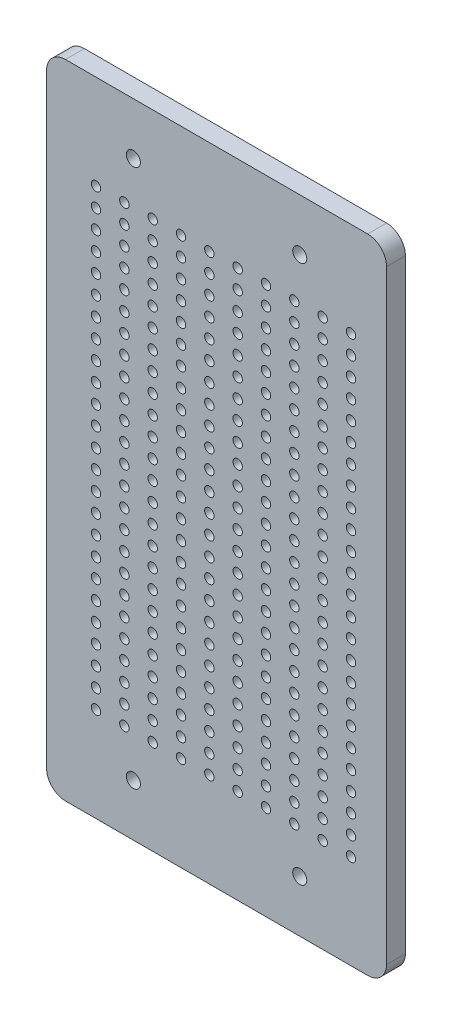
from build123d import *

# Parameters (mm, degrees)
SKETCH_1_R      = 3.725
SKETCH_1_R_2    = 2.5
EXTRUDE_1_DEPTH = 10


with BuildPart() as part:
    # 草图1 → 凸台-拉伸1 (new body)
    with BuildSketch(Plane.XY):
        with BuildLine():
            Line((-80, 170), (80, 170))
            ThreePointArc((80, 170), (87.071067812, 167.071067812), (90, 160))
            Line((90, 160), (90, -160))
            ThreePointArc((90, -160), (87.071067812, -167.071067812), (80, -170))
            Line((80, -170), (-80, -170))
            ThreePointArc((-80, -170), (-87.071067812, -167.071067812), (-90, -160))
            Line((-90, -160), (-90, 160))
            ThreePointArc((-90, 160), (-87.071067812, 167.071067812), (-80, 170))
        make_face()
        with Locations((-44.05, -142.55)):
            Circle(SKETCH_1_R, mode=Mode.SUBTRACT)
        with Locations(Location((44.05, -142.55, 0), (0, 0, 180))):
            Circle(SKETCH_1_R, mode=Mode.SUBTRACT)
        with Locations((44.05, 142.55)):
            Circle(SKETCH_1_R, mode=Mode.SUBTRACT)
        with Locations(Location((-44.05, 142.55, 0), (0, 0, 180))):
            Circle(SKETCH_1_R, mode=Mode.SUBTRACT)
        with Locations((-63.816557391, -120)):
            Circle(SKETCH_1_R_2, mode=Mode.SUBTRACT)
        with Locations((-48.816557391, -120)):
            Circle(SKETCH_1_R_2, mode=Mode.SUBTRACT)
        with Locations((-33.816557391, -120)):
            Circle(SKETCH_1_R_2, mode=Mode.SUBTRACT)
        with Locations((-18.816557391, -120)):
            Circle(SKETCH_1_R_2, mode=Mode.SUBTRACT)
        with Locations((-3.816557391, -120)):
            Circle(SKETCH_1_R_2, mode=Mode.SUBTRACT)
        with Locations((11.183442609, -120)):
            Circle(SKETCH_1_R_2, mode=Mode.SUBTRACT)
        with Locations((26.183442609, -120)):
            Circle(SKETCH_1_R_2, mode=Mode.SUBTRACT)
        with Locations((41.183442609, -120)):
            Circle(SKETCH_1_R_2, mode=Mode.SUBTRACT)
        with Locations((56.183442609, -120)):
            Circle(SKETCH_1_R_2, mode=Mode.SUBTRACT)
        with Locations((71.183442609, -120)):
            Circle(SKETCH_1_R_2, mode=Mode.SUBTRACT)
        with Locations((-48.816557391, -110)):
            Circle(SKETCH_1_R_2, mode=Mode.SUBTRACT)
        with Locations((-33.816557391, -110)):
            Circle(SKETCH_1_R_2, mode=Mode.SUBTRACT)
        with Locations((-18.816557391, -110)):
            Circle(SKETCH_1_R_2, mode=Mode.SUBTRACT)
        with Locations((-3.816557391, -110)):
            Circle(SKETCH_1_R_2, mode=Mode.SUBTRACT)
        with Locations((11.183442609, -110)):
            Circle(SKETCH_1_R_2, mode=Mode.SUBTRACT)
        with Locations((26.183442609, -110)):
            Circle(SKETCH_1_R_2, mode=Mode.SUBTRACT)
        with Locations((41.183442609, -110)):
            Circle(SKETCH_1_R_2, mode=Mode.SUBTRACT)
        with Locations((56.183442609, -110)):
            Circle(SKETCH_1_R_2, mode=Mode.SUBTRACT)
        with Locations((71.183442609, -110)):
            Circle(SKETCH_1_R_2, mode=Mode.SUBTRACT)
        with Locations((-48.816557391, -100)):
            Circle(SKETCH_1_R_2, mode=Mode.SUBTRACT)
        with Locations((-33.816557391, -100)):
            Circle(SKETCH_1_R_2, mode=Mode.SUBTRACT)
        with Locations((-18.816557391, -100)):
            Circle(SKETCH_1_R_2, mode=Mode.SUBTRACT)
        with Locations((-3.816557391, -100)):
            Circle(SKETCH_1_R_2, mode=Mode.SUBTRACT)
        with Locations((11.183442609, -100)):
            Circle(SKETCH_1_R_2, mode=Mode.SUBTRACT)
        with Locations((26.183442609, -100)):
            Circle(SKETCH_1_R_2, mode=Mode.SUBTRACT)
        with Locations((41.183442609, -100)):
            Circle(SKETCH_1_R_2, mode=Mode.SUBTRACT)
        with Locations((56.183442609, -100)):
            Circle(SKETCH_1_R_2, mode=Mode.SUBTRACT)
        with Locations((71.183442609, -100)):
            Circle(SKETCH_1_R_2, mode=Mode.SUBTRACT)
        with Locations((-48.816557391, -90)):
            Circle(SKETCH_1_R_2, mode=Mode.SUBTRACT)
        with Locations((-33.816557391, -90)):
            Circle(SKETCH_1_R_2, mode=Mode.SUBTRACT)
        with Locations((-18.816557391, -90)):
            Circle(SKETCH_1_R_2, mode=Mode.SUBTRACT)
        with Locations((-3.816557391, -90)):
            Circle(SKETCH_1_R_2, mode=Mode.SUBTRACT)
        with Locations((11.183442609, -90)):
            Circle(SKETCH_1_R_2, mode=Mode.SUBTRACT)
        with Locations((26.183442609, -90)):
            Circle(SKETCH_1_R_2, mode=Mode.SUBTRACT)
        with Locations((41.183442609, -90)):
            Circle(SKETCH_1_R_2, mode=Mode.SUBTRACT)
        with Locations((56.183442609, -90)):
            Circle(SKETCH_1_R_2, mode=Mode.SUBTRACT)
        with Locations((71.183442609, -90)):
            Circle(SKETCH_1_R_2, mode=Mode.SUBTRACT)
        with Locations((-48.816557391, -80)):
            Circle(SKETCH_1_R_2, mode=Mode.SUBTRACT)
        with Locations((-33.816557391, -80)):
            Circle(SKETCH_1_R_2, mode=Mode.SUBTRACT)
        with Locations((-18.816557391, -80)):
            Circle(SKETCH_1_R_2, mode=Mode.SUBTRACT)
        with Locations((-3.816557391, -80)):
            Circle(SKETCH_1_R_2, mode=Mode.SUBTRACT)
        with Locations((11.183442609, -80)):
            Circle(SKETCH_1_R_2, mode=Mode.SUBTRACT)
        with Locations((26.183442609, -80)):
            Circle(SKETCH_1_R_2, mode=Mode.SUBTRACT)
        with Locations((41.183442609, -80)):
            Circle(SKETCH_1_R_2, mode=Mode.SUBTRACT)
        with Locations((56.183442609, -80)):
            Circle(SKETCH_1_R_2, mode=Mode.SUBTRACT)
        with Locations((71.183442609, -80)):
            Circle(SKETCH_1_R_2, mode=Mode.SUBTRACT)
        with Locations((-48.816557391, -70)):
            Circle(SKETCH_1_R_2, mode=Mode.SUBTRACT)
        with Locations((-33.816557391, -70)):
            Circle(SKETCH_1_R_2, mode=Mode.SUBTRACT)
        with Locations((-18.816557391, -70)):
            Circle(SKETCH_1_R_2, mode=Mode.SUBTRACT)
        with Locations((-3.816557391, -70)):
            Circle(SKETCH_1_R_2, mode=Mode.SUBTRACT)
        with Locations((11.183442609, -70)):
            Circle(SKETCH_1_R_2, mode=Mode.SUBTRACT)
        with Locations((26.183442609, -70)):
            Circle(SKETCH_1_R_2, mode=Mode.SUBTRACT)
        with Locations((41.183442609, -70)):
            Circle(SKETCH_1_R_2, mode=Mode.SUBTRACT)
        with Locations((56.183442609, -70)):
            Circle(SKETCH_1_R_2, mode=Mode.SUBTRACT)
        with Locations((71.183442609, -70)):
            Circle(SKETCH_1_R_2, mode=Mode.SUBTRACT)
        with Locations((-48.816557391, -60)):
            Circle(SKETCH_1_R_2, mode=Mode.SUBTRACT)
        with Locations((-33.816557391, -60)):
            Circle(SKETCH_1_R_2, mode=Mode.SUBTRACT)
        with Locations((-18.816557391, -60)):
            Circle(SKETCH_1_R_2, mode=Mode.SUBTRACT)
        with Locations((-3.816557391, -60)):
            Circle(SKETCH_1_R_2, mode=Mode.SUBTRACT)
        with Locations((11.183442609, -60)):
            Circle(SKETCH_1_R_2, mode=Mode.SUBTRACT)
        with Locations((26.183442609, -60)):
            Circle(SKETCH_1_R_2, mode=Mode.SUBTRACT)
        with Locations((41.183442609, -60)):
            Circle(SKETCH_1_R_2, mode=Mode.SUBTRACT)
        with Locations((56.183442609, -60)):
            Circle(SKETCH_1_R_2, mode=Mode.SUBTRACT)
        with Locations((71.183442609, -60)):
            Circle(SKETCH_1_R_2, mode=Mode.SUBTRACT)
        with Locations((-48.816557391, -50)):
            Circle(SKETCH_1_R_2, mode=Mode.SUBTRACT)
        with Locations((-33.816557391, -50)):
            Circle(SKETCH_1_R_2, mode=Mode.SUBTRACT)
        with Locations((-18.816557391, -50)):
            Circle(SKETCH_1_R_2, mode=Mode.SUBTRACT)
        with Locations((-3.816557391, -50)):
            Circle(SKETCH_1_R_2, mode=Mode.SUBTRACT)
        with Locations((11.183442609, -50)):
            Circle(SKETCH_1_R_2, mode=Mode.SUBTRACT)
        with Locations((26.183442609, -50)):
            Circle(SKETCH_1_R_2, mode=Mode.SUBTRACT)
        with Locations((41.183442609, -50)):
            Circle(SKETCH_1_R_2, mode=Mode.SUBTRACT)
        with Locations((56.183442609, -50)):
            Circle(SKETCH_1_R_2, mode=Mode.SUBTRACT)
        with Locations((71.183442609, -50)):
            Circle(SKETCH_1_R_2, mode=Mode.SUBTRACT)
        with Locations((-48.816557391, -40)):
            Circle(SKETCH_1_R_2, mode=Mode.SUBTRACT)
        with Locations((-33.816557391, -40)):
            Circle(SKETCH_1_R_2, mode=Mode.SUBTRACT)
        with Locations((-18.816557391, -40)):
            Circle(SKETCH_1_R_2, mode=Mode.SUBTRACT)
        with Locations((-3.816557391, -40)):
            Circle(SKETCH_1_R_2, mode=Mode.SUBTRACT)
        with Locations((11.183442609, -40)):
            Circle(SKETCH_1_R_2, mode=Mode.SUBTRACT)
        with Locations((26.183442609, -40)):
            Circle(SKETCH_1_R_2, mode=Mode.SUBTRACT)
        with Locations((41.183442609, -40)):
            Circle(SKETCH_1_R_2, mode=Mode.SUBTRACT)
        with Locations((56.183442609, -40)):
            Circle(SKETCH_1_R_2, mode=Mode.SUBTRACT)
        with Locations((71.183442609, -40)):
            Circle(SKETCH_1_R_2, mode=Mode.SUBTRACT)
        with Locations((-48.816557391, -30)):
            Circle(SKETCH_1_R_2, mode=Mode.SUBTRACT)
        with Locations((-33.816557391, -30)):
            Circle(SKETCH_1_R_2, mode=Mode.SUBTRACT)
        with Locations((-18.816557391, -30)):
            Circle(SKETCH_1_R_2, mode=Mode.SUBTRACT)
        with Locations((-3.816557391, -30)):
            Circle(SKETCH_1_R_2, mode=Mode.SUBTRACT)
        with Locations((11.183442609, -30)):
            Circle(SKETCH_1_R_2, mode=Mode.SUBTRACT)
        with Locations((26.183442609, -30)):
            Circle(SKETCH_1_R_2, mode=Mode.SUBTRACT)
        with Locations((41.183442609, -30)):
            Circle(SKETCH_1_R_2, mode=Mode.SUBTRACT)
        with Locations((56.183442609, -30)):
            Circle(SKETCH_1_R_2, mode=Mode.SUBTRACT)
        with Locations((71.183442609, -30)):
            Circle(SKETCH_1_R_2, mode=Mode.SUBTRACT)
        with Locations((-48.816557391, -20)):
            Circle(SKETCH_1_R_2, mode=Mode.SUBTRACT)
        with Locations((-33.816557391, -20)):
            Circle(SKETCH_1_R_2, mode=Mode.SUBTRACT)
        with Locations((-18.816557391, -20)):
            Circle(SKETCH_1_R_2, mode=Mode.SUBTRACT)
        with Locations((-3.816557391, -20)):
            Circle(SKETCH_1_R_2, mode=Mode.SUBTRACT)
        with Locations((11.183442609, -20)):
            Circle(SKETCH_1_R_2, mode=Mode.SUBTRACT)
        with Locations((26.183442609, -20)):
            Circle(SKETCH_1_R_2, mode=Mode.SUBTRACT)
        with Locations((41.183442609, -20)):
            Circle(SKETCH_1_R_2, mode=Mode.SUBTRACT)
        with Locations((56.183442609, -20)):
            Circle(SKETCH_1_R_2, mode=Mode.SUBTRACT)
        with Locations((71.183442609, -20)):
            Circle(SKETCH_1_R_2, mode=Mode.SUBTRACT)
        with Locations((-48.816557391, -10)):
            Circle(SKETCH_1_R_2, mode=Mode.SUBTRACT)
        with Locations((-33.816557391, -10)):
            Circle(SKETCH_1_R_2, mode=Mode.SUBTRACT)
        with Locations((-18.816557391, -10)):
            Circle(SKETCH_1_R_2, mode=Mode.SUBTRACT)
        with Locations((-3.816557391, -10)):
            Circle(SKETCH_1_R_2, mode=Mode.SUBTRACT)
        with Locations((11.183442609, -10)):
            Circle(SKETCH_1_R_2, mode=Mode.SUBTRACT)
        with Locations((26.183442609, -10)):
            Circle(SKETCH_1_R_2, mode=Mode.SUBTRACT)
        with Locations((41.183442609, -10)):
            Circle(SKETCH_1_R_2, mode=Mode.SUBTRACT)
        with Locations((56.183442609, -10)):
            Circle(SKETCH_1_R_2, mode=Mode.SUBTRACT)
        with Locations((71.183442609, -10)):
            Circle(SKETCH_1_R_2, mode=Mode.SUBTRACT)
        with Locations((-48.816557391, 0)):
            Circle(SKETCH_1_R_2, mode=Mode.SUBTRACT)
        with Locations((-33.816557391, 0)):
            Circle(SKETCH_1_R_2, mode=Mode.SUBTRACT)
        with Locations((-18.816557391, 0)):
            Circle(SKETCH_1_R_2, mode=Mode.SUBTRACT)
        with Locations((-3.816557391, 0)):
            Circle(SKETCH_1_R_2, mode=Mode.SUBTRACT)
        with Locations((11.183442609, 0)):
            Circle(SKETCH_1_R_2, mode=Mode.SUBTRACT)
        with Locations((26.183442609, 0)):
            Circle(SKETCH_1_R_2, mode=Mode.SUBTRACT)
        with Locations((41.183442609, 0)):
            Circle(SKETCH_1_R_2, mode=Mode.SUBTRACT)
        with Locations((56.183442609, 0)):
            Circle(SKETCH_1_R_2, mode=Mode.SUBTRACT)
        with Locations((71.183442609, 0)):
            Circle(SKETCH_1_R_2, mode=Mode.SUBTRACT)
        with Locations((-48.816557391, 10)):
            Circle(SKETCH_1_R_2, mode=Mode.SUBTRACT)
        with Locations((-33.816557391, 10)):
            Circle(SKETCH_1_R_2, mode=Mode.SUBTRACT)
        with Locations((-18.816557391, 10)):
            Circle(SKETCH_1_R_2, mode=Mode.SUBTRACT)
        with Locations((-3.816557391, 10)):
            Circle(SKETCH_1_R_2, mode=Mode.SUBTRACT)
        with Locations((11.183442609, 10)):
            Circle(SKETCH_1_R_2, mode=Mode.SUBTRACT)
        with Locations((26.183442609, 10)):
            Circle(SKETCH_1_R_2, mode=Mode.SUBTRACT)
        with Locations((41.183442609, 10)):
            Circle(SKETCH_1_R_2, mode=Mode.SUBTRACT)
        with Locations((56.183442609, 10)):
            Circle(SKETCH_1_R_2, mode=Mode.SUBTRACT)
        with Locations((71.183442609, 10)):
            Circle(SKETCH_1_R_2, mode=Mode.SUBTRACT)
        with Locations((-48.816557391, 20)):
            Circle(SKETCH_1_R_2, mode=Mode.SUBTRACT)
        with Locations((-33.816557391, 20)):
            Circle(SKETCH_1_R_2, mode=Mode.SUBTRACT)
        with Locations((-18.816557391, 20)):
            Circle(SKETCH_1_R_2, mode=Mode.SUBTRACT)
        with Locations((-3.816557391, 20)):
            Circle(SKETCH_1_R_2, mode=Mode.SUBTRACT)
        with Locations((11.183442609, 20)):
            Circle(SKETCH_1_R_2, mode=Mode.SUBTRACT)
        with Locations((26.183442609, 20)):
            Circle(SKETCH_1_R_2, mode=Mode.SUBTRACT)
        with Locations((41.183442609, 20)):
            Circle(SKETCH_1_R_2, mode=Mode.SUBTRACT)
        with Locations((56.183442609, 20)):
            Circle(SKETCH_1_R_2, mode=Mode.SUBTRACT)
        with Locations((71.183442609, 20)):
            Circle(SKETCH_1_R_2, mode=Mode.SUBTRACT)
        with Locations((-48.816557391, 30)):
            Circle(SKETCH_1_R_2, mode=Mode.SUBTRACT)
        with Locations((-33.816557391, 30)):
            Circle(SKETCH_1_R_2, mode=Mode.SUBTRACT)
        with Locations((-18.816557391, 30)):
            Circle(SKETCH_1_R_2, mode=Mode.SUBTRACT)
        with Locations((-3.816557391, 30)):
            Circle(SKETCH_1_R_2, mode=Mode.SUBTRACT)
        with Locations((11.183442609, 30)):
            Circle(SKETCH_1_R_2, mode=Mode.SUBTRACT)
        with Locations((26.183442609, 30)):
            Circle(SKETCH_1_R_2, mode=Mode.SUBTRACT)
        with Locations((41.183442609, 30)):
            Circle(SKETCH_1_R_2, mode=Mode.SUBTRACT)
        with Locations((56.183442609, 30)):
            Circle(SKETCH_1_R_2, mode=Mode.SUBTRACT)
        with Locations((71.183442609, 30)):
            Circle(SKETCH_1_R_2, mode=Mode.SUBTRACT)
        with Locations((-48.816557391, 40)):
            Circle(SKETCH_1_R_2, mode=Mode.SUBTRACT)
        with Locations((-33.816557391, 40)):
            Circle(SKETCH_1_R_2, mode=Mode.SUBTRACT)
        with Locations((-18.816557391, 40)):
            Circle(SKETCH_1_R_2, mode=Mode.SUBTRACT)
        with Locations((-3.816557391, 40)):
            Circle(SKETCH_1_R_2, mode=Mode.SUBTRACT)
        with Locations((11.183442609, 40)):
            Circle(SKETCH_1_R_2, mode=Mode.SUBTRACT)
        with Locations((26.183442609, 40)):
            Circle(SKETCH_1_R_2, mode=Mode.SUBTRACT)
        with Locations((41.183442609, 40)):
            Circle(SKETCH_1_R_2, mode=Mode.SUBTRACT)
        with Locations((56.183442609, 40)):
            Circle(SKETCH_1_R_2, mode=Mode.SUBTRACT)
        with Locations((71.183442609, 40)):
            Circle(SKETCH_1_R_2, mode=Mode.SUBTRACT)
        with Locations((-48.816557391, 50)):
            Circle(SKETCH_1_R_2, mode=Mode.SUBTRACT)
        with Locations((-33.816557391, 50)):
            Circle(SKETCH_1_R_2, mode=Mode.SUBTRACT)
        with Locations((-18.816557391, 50)):
            Circle(SKETCH_1_R_2, mode=Mode.SUBTRACT)
        with Locations((-3.816557391, 50)):
            Circle(SKETCH_1_R_2, mode=Mode.SUBTRACT)
        with Locations((11.183442609, 50)):
            Circle(SKETCH_1_R_2, mode=Mode.SUBTRACT)
        with Locations((26.183442609, 50)):
            Circle(SKETCH_1_R_2, mode=Mode.SUBTRACT)
        with Locations((41.183442609, 50)):
            Circle(SKETCH_1_R_2, mode=Mode.SUBTRACT)
        with Locations((56.183442609, 50)):
            Circle(SKETCH_1_R_2, mode=Mode.SUBTRACT)
        with Locations((71.183442609, 50)):
            Circle(SKETCH_1_R_2, mode=Mode.SUBTRACT)
        with Locations((-48.816557391, 60)):
            Circle(SKETCH_1_R_2, mode=Mode.SUBTRACT)
        with Locations((-33.816557391, 60)):
            Circle(SKETCH_1_R_2, mode=Mode.SUBTRACT)
        with Locations((-18.816557391, 60)):
            Circle(SKETCH_1_R_2, mode=Mode.SUBTRACT)
        with Locations((-3.816557391, 60)):
            Circle(SKETCH_1_R_2, mode=Mode.SUBTRACT)
        with Locations((11.183442609, 60)):
            Circle(SKETCH_1_R_2, mode=Mode.SUBTRACT)
        with Locations((26.183442609, 60)):
            Circle(SKETCH_1_R_2, mode=Mode.SUBTRACT)
        with Locations((41.183442609, 60)):
            Circle(SKETCH_1_R_2, mode=Mode.SUBTRACT)
        with Locations((56.183442609, 60)):
            Circle(SKETCH_1_R_2, mode=Mode.SUBTRACT)
        with Locations((71.183442609, 60)):
            Circle(SKETCH_1_R_2, mode=Mode.SUBTRACT)
        with Locations((-48.816557391, 70)):
            Circle(SKETCH_1_R_2, mode=Mode.SUBTRACT)
        with Locations((-33.816557391, 70)):
            Circle(SKETCH_1_R_2, mode=Mode.SUBTRACT)
        with Locations((-18.816557391, 70)):
            Circle(SKETCH_1_R_2, mode=Mode.SUBTRACT)
        with Locations((-3.816557391, 70)):
            Circle(SKETCH_1_R_2, mode=Mode.SUBTRACT)
        with Locations((11.183442609, 70)):
            Circle(SKETCH_1_R_2, mode=Mode.SUBTRACT)
        with Locations((26.183442609, 70)):
            Circle(SKETCH_1_R_2, mode=Mode.SUBTRACT)
        with Locations((41.183442609, 70)):
            Circle(SKETCH_1_R_2, mode=Mode.SUBTRACT)
        with Locations((56.183442609, 70)):
            Circle(SKETCH_1_R_2, mode=Mode.SUBTRACT)
        with Locations((71.183442609, 70)):
            Circle(SKETCH_1_R_2, mode=Mode.SUBTRACT)
        with Locations((-48.816557391, 80)):
            Circle(SKETCH_1_R_2, mode=Mode.SUBTRACT)
        with Locations((-33.816557391, 80)):
            Circle(SKETCH_1_R_2, mode=Mode.SUBTRACT)
        with Locations((-18.816557391, 80)):
            Circle(SKETCH_1_R_2, mode=Mode.SUBTRACT)
        with Locations((-3.816557391, 80)):
            Circle(SKETCH_1_R_2, mode=Mode.SUBTRACT)
        with Locations((11.183442609, 80)):
            Circle(SKETCH_1_R_2, mode=Mode.SUBTRACT)
        with Locations((26.183442609, 80)):
            Circle(SKETCH_1_R_2, mode=Mode.SUBTRACT)
        with Locations((41.183442609, 80)):
            Circle(SKETCH_1_R_2, mode=Mode.SUBTRACT)
        with Locations((56.183442609, 80)):
            Circle(SKETCH_1_R_2, mode=Mode.SUBTRACT)
        with Locations((71.183442609, 80)):
            Circle(SKETCH_1_R_2, mode=Mode.SUBTRACT)
        with Locations((-48.816557391, 90)):
            Circle(SKETCH_1_R_2, mode=Mode.SUBTRACT)
        with Locations((-33.816557391, 90)):
            Circle(SKETCH_1_R_2, mode=Mode.SUBTRACT)
        with Locations((-18.816557391, 90)):
            Circle(SKETCH_1_R_2, mode=Mode.SUBTRACT)
        with Locations((-3.816557391, 90)):
            Circle(SKETCH_1_R_2, mode=Mode.SUBTRACT)
        with Locations((11.183442609, 90)):
            Circle(SKETCH_1_R_2, mode=Mode.SUBTRACT)
        with Locations((26.183442609, 90)):
            Circle(SKETCH_1_R_2, mode=Mode.SUBTRACT)
        with Locations((41.183442609, 90)):
            Circle(SKETCH_1_R_2, mode=Mode.SUBTRACT)
        with Locations((56.183442609, 90)):
            Circle(SKETCH_1_R_2, mode=Mode.SUBTRACT)
        with Locations((71.183442609, 90)):
            Circle(SKETCH_1_R_2, mode=Mode.SUBTRACT)
        with Locations((-48.816557391, 100)):
            Circle(SKETCH_1_R_2, mode=Mode.SUBTRACT)
        with Locations((-33.816557391, 100)):
            Circle(SKETCH_1_R_2, mode=Mode.SUBTRACT)
        with Locations((-18.816557391, 100)):
            Circle(SKETCH_1_R_2, mode=Mode.SUBTRACT)
        with Locations((-3.816557391, 100)):
            Circle(SKETCH_1_R_2, mode=Mode.SUBTRACT)
        with Locations((11.183442609, 100)):
            Circle(SKETCH_1_R_2, mode=Mode.SUBTRACT)
        with Locations((26.183442609, 100)):
            Circle(SKETCH_1_R_2, mode=Mode.SUBTRACT)
        with Locations((41.183442609, 100)):
            Circle(SKETCH_1_R_2, mode=Mode.SUBTRACT)
        with Locations((56.183442609, 100)):
            Circle(SKETCH_1_R_2, mode=Mode.SUBTRACT)
        with Locations((71.183442609, 100)):
            Circle(SKETCH_1_R_2, mode=Mode.SUBTRACT)
        with Locations((-48.816557391, 110)):
            Circle(SKETCH_1_R_2, mode=Mode.SUBTRACT)
        with Locations((-33.816557391, 110)):
            Circle(SKETCH_1_R_2, mode=Mode.SUBTRACT)
        with Locations((-18.816557391, 110)):
            Circle(SKETCH_1_R_2, mode=Mode.SUBTRACT)
        with Locations((-3.816557391, 110)):
            Circle(SKETCH_1_R_2, mode=Mode.SUBTRACT)
        with Locations((11.183442609, 110)):
            Circle(SKETCH_1_R_2, mode=Mode.SUBTRACT)
        with Locations((26.183442609, 110)):
            Circle(SKETCH_1_R_2, mode=Mode.SUBTRACT)
        with Locations((41.183442609, 110)):
            Circle(SKETCH_1_R_2, mode=Mode.SUBTRACT)
        with Locations((56.183442609, 110)):
            Circle(SKETCH_1_R_2, mode=Mode.SUBTRACT)
        with Locations((71.183442609, 110)):
            Circle(SKETCH_1_R_2, mode=Mode.SUBTRACT)
        with Locations((-48.816557391, 120)):
            Circle(SKETCH_1_R_2, mode=Mode.SUBTRACT)
        with Locations((-33.816557391, 120)):
            Circle(SKETCH_1_R_2, mode=Mode.SUBTRACT)
        with Locations((-18.816557391, 120)):
            Circle(SKETCH_1_R_2, mode=Mode.SUBTRACT)
        with Locations((-3.816557391, 120)):
            Circle(SKETCH_1_R_2, mode=Mode.SUBTRACT)
        with Locations((11.183442609, 120)):
            Circle(SKETCH_1_R_2, mode=Mode.SUBTRACT)
        with Locations((26.183442609, 120)):
            Circle(SKETCH_1_R_2, mode=Mode.SUBTRACT)
        with Locations((41.183442609, 120)):
            Circle(SKETCH_1_R_2, mode=Mode.SUBTRACT)
        with Locations((56.183442609, 120)):
            Circle(SKETCH_1_R_2, mode=Mode.SUBTRACT)
        with Locations((71.183442609, 120)):
            Circle(SKETCH_1_R_2, mode=Mode.SUBTRACT)
        with Locations((-63.816557391, -110)):
            Circle(SKETCH_1_R_2, mode=Mode.SUBTRACT)
        with Locations((-63.816557391, -100)):
            Circle(SKETCH_1_R_2, mode=Mode.SUBTRACT)
        with Locations((-63.816557391, -90)):
            Circle(SKETCH_1_R_2, mode=Mode.SUBTRACT)
        with Locations((-63.816557391, -80)):
            Circle(SKETCH_1_R_2, mode=Mode.SUBTRACT)
        with Locations((-63.816557391, -70)):
            Circle(SKETCH_1_R_2, mode=Mode.SUBTRACT)
        with Locations((-63.816557391, -60)):
            Circle(SKETCH_1_R_2, mode=Mode.SUBTRACT)
        with Locations((-63.816557391, -50)):
            Circle(SKETCH_1_R_2, mode=Mode.SUBTRACT)
        with Locations((-63.816557391, -40)):
            Circle(SKETCH_1_R_2, mode=Mode.SUBTRACT)
        with Locations((-63.816557391, -30)):
            Circle(SKETCH_1_R_2, mode=Mode.SUBTRACT)
        with Locations((-63.816557391, -20)):
            Circle(SKETCH_1_R_2, mode=Mode.SUBTRACT)
        with Locations((-63.816557391, -10)):
            Circle(SKETCH_1_R_2, mode=Mode.SUBTRACT)
        with Locations((-63.816557391, 0)):
            Circle(SKETCH_1_R_2, mode=Mode.SUBTRACT)
        with Locations((-63.816557391, 10)):
            Circle(SKETCH_1_R_2, mode=Mode.SUBTRACT)
        with Locations((-63.816557391, 20)):
            Circle(SKETCH_1_R_2, mode=Mode.SUBTRACT)
        with Locations((-63.816557391, 30)):
            Circle(SKETCH_1_R_2, mode=Mode.SUBTRACT)
        with Locations((-63.816557391, 40)):
            Circle(SKETCH_1_R_2, mode=Mode.SUBTRACT)
        with Locations((-63.816557391, 50)):
            Circle(SKETCH_1_R_2, mode=Mode.SUBTRACT)
        with Locations((-63.816557391, 60)):
            Circle(SKETCH_1_R_2, mode=Mode.SUBTRACT)
        with Locations((-63.816557391, 70)):
            Circle(SKETCH_1_R_2, mode=Mode.SUBTRACT)
        with Locations((-63.816557391, 80)):
            Circle(SKETCH_1_R_2, mode=Mode.SUBTRACT)
        with Locations((-63.816557391, 90)):
            Circle(SKETCH_1_R_2, mode=Mode.SUBTRACT)
        with Locations((-63.816557391, 100)):
            Circle(SKETCH_1_R_2, mode=Mode.SUBTRACT)
        with Locations((-63.816557391, 110)):
            Circle(SKETCH_1_R_2, mode=Mode.SUBTRACT)
        with Locations((-63.816557391, 120)):
            Circle(SKETCH_1_R_2, mode=Mode.SUBTRACT)
    extrude(amount=EXTRUDE_1_DEPTH)


solid = part.part
